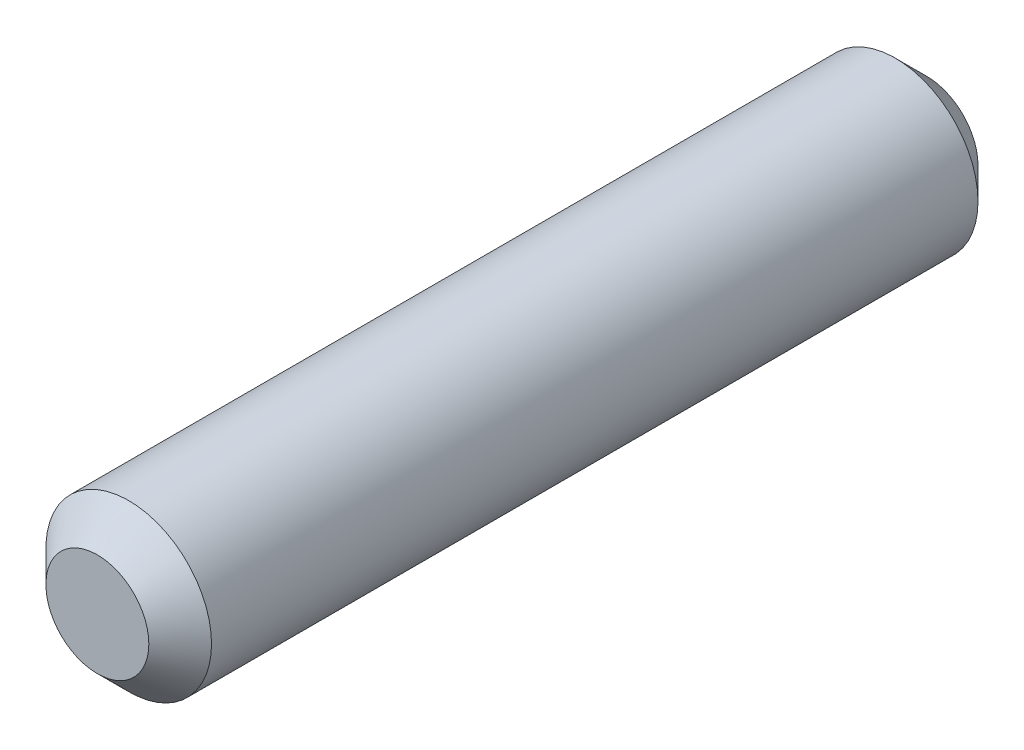
from build123d import *

# Parameters (mm, degrees)
SKETCH2_R           = 1.585
BOSS_EXTRUDE2_DEPTH = 7.935
CHAMFER1_SIZE       = 0.6


with BuildPart() as part:
    # Sketch2 → Boss-Extrude2 (new, symmetric)
    with BuildSketch(Plane.XY):
        Circle(SKETCH2_R)
    extrude(amount=BOSS_EXTRUDE2_DEPTH, both=True)

    # Chamfer1
    chamfer1_edges = [part.edges().sort_by_distance(p)[0] for p in [
        (-1.585, 0, -7.935),
        (-1.585, 0, 7.935),
    ]]
    chamfer(chamfer1_edges, length=CHAMFER1_SIZE)


solid = part.part
